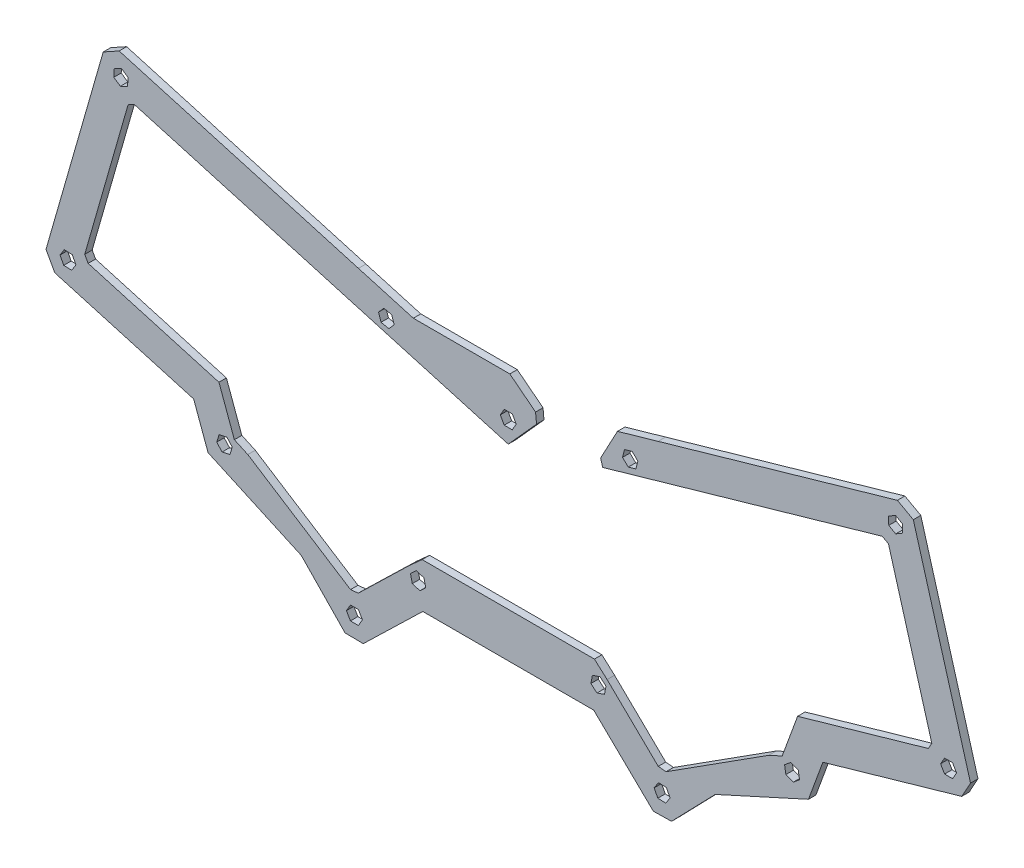
from build123d import *

# Parameters (mm, degrees)
BOSS_EXTRU_1_DEPTH = 3


with BuildPart() as part:
    # Esquisse1 → Boss.-Extru.1 (new body)
    with BuildSketch(Plane.XY):
        Polygon((-207.540430482, -98.290842938), (-228.119574859, -118.248029963), (-231.240854108, -118.563827288), (-272.565847516, -92.169507978), (-277.959789872, -89.716454796), (-284.165989399, -72.783703169), (-336.775785376, -57.698086926), (-338.147034057, -55.224288823), (-320.713145188, 5.574907028), (-318.239316427, 6.946262636), (-167.795259872, -36.183821192), (-156.425730461, -23.544541546), (-156.815310501, -19.508703235), (-167.175777529, -11.401531345), (-205.982988252, -11.401531345), (-221.327812729, -7.001473731), (-228.053301524, -5.072970852), (-324.305573392, 22.521130566), (-330.707501003, 18.97225141), (-353.72243999, -61.290379239), (-350.173829458, -67.692242105), (-294.328030452, -83.705767284), (-288.532091821, -99.519179156), (-251.042661762, -116.568594893), (-233.45174982, -134.735979634), (-226.135810249, -134.851076098), (-202.175390102, -111.650948678), (-133.415129641, -111.650948678), (-109.454709494, -134.851076098), (-102.138769923, -134.735979634), (-84.547857981, -116.568594893), (-47.058427922, -99.519179156), (-41.262489291, -83.705767284), (14.583309715, -67.692242105), (18.131920247, -61.290379239), (-4.88301874, 18.97225141), (-11.284946351, 22.521130566), (-107.537218219, -5.072970852), (-114.262707014, -7.001473731), (-123.876268292, -9.758118068), (-130.649820486, -22.415487094), (-129.8232917, -25.297935522), (-127.904950096, -24.747859919), (-17.351203316, 6.946262636), (-14.877374555, 5.574907028), (2.556514314, -55.224288823), (1.185265633, -57.698086926), (-51.424530344, -72.783703169), (-57.630729871, -89.716454796), (-63.024672228, -92.169507978), (-104.349665635, -118.563827288), (-107.470944884, -118.248029963), (-128.050089261, -98.290842938), (-133.151477342, -93.715936913), (-202.439042401, -93.715936913), align=None)
        Polygon((-214.696831686, -14.527657653), (-217.840116073, -13.876277124), (-219.975870353, -16.272750989), (-218.968340246, -19.320605385), (-215.825055858, -19.971985915), (-213.689301579, -17.575512049), align=None, mode=Mode.SUBTRACT)
        Polygon((-166.175746894, -24.833958909), (-169.385770719, -24.817214521), (-171.005283697, -27.588804506), (-169.414772849, -30.37713888), (-166.204749024, -30.393883267), (-164.585236046, -27.622293282), align=None, mode=Mode.SUBTRACT)
        Polygon((-115.672169645, -16.039488624), (-117.981174931, -13.809459943), (-121.066939064, -14.694102838), (-121.84369791, -17.808774414), (-119.534692623, -20.038803095), (-116.448928491, -19.154160201), align=None, mode=Mode.SUBTRACT)
        Polygon((-9.240055353, 15.320178943), (-12.039253575, 16.891491339), (-14.799649138, 15.252970767), (-14.76084648, 12.043137798), (-11.961648258, 10.471825402), (-9.201252694, 12.110345974), align=None, mode=Mode.SUBTRACT)
        Polygon((12.502351781, -60.574933915), (10.897318032, -57.794933915), (7.687250536, -57.794933915), (6.082216787, -60.574933915), (7.687250536, -63.354933915), (10.897318032, -63.354933915), align=None, mode=Mode.SUBTRACT)
        Polygon((-50.649763202, -94.526851626), (-51.178552765, -91.36063702), (-54.18496983, -90.235474912), (-56.662597331, -92.27652741), (-56.133807767, -95.442742016), (-53.127390703, -96.567904124), align=None, mode=Mode.SUBTRACT)
        Polygon((-104.440215275, -129.559925429), (-102.716844109, -126.851692582), (-104.200556971, -124.005092948), (-107.407640999, -123.866726161), (-109.131012166, -126.574959009), (-107.647299303, -129.421558643), align=None, mode=Mode.SUBTRACT)
        Polygon((-132.134816884, -105.032961295), (-129.102521286, -103.979530359), (-128.498671438, -100.826769871), (-130.927117189, -98.727440319), (-133.959412787, -99.780871255), (-134.563262635, -102.933631743), align=None, mode=Mode.SUBTRACT)
        Polygon((-200.986265397, -102.807259839), (-201.720052379, -99.68218544), (-204.793339689, -98.755126408), (-207.132840016, -100.953141775), (-206.399053033, -104.078216174), (-203.325765724, -105.005275206), align=None, mode=Mode.SUBTRACT)
        Polygon((-228.072581173, -129.499661036), (-226.456549288, -126.726039887), (-228.050559721, -123.939704646), (-231.260602039, -123.926990555), (-232.876633924, -126.700611704), (-231.282623491, -129.486946945), align=None, mode=Mode.SUBTRACT)
        Polygon((-279.761510176, -95.764600045), (-278.801584282, -92.701419409), (-280.974413583, -90.338508881), (-284.107168778, -91.03877899), (-285.067094671, -94.101959627), (-282.89426537, -96.464870154), align=None, mode=Mode.SUBTRACT)
        Polygon((-343.381773974, -63.412440235), (-341.674936445, -60.693756917), (-343.175966498, -57.856250598), (-346.38383408, -57.737427596), (-348.09067161, -60.456110913), (-346.589641557, -63.293617233), align=None, mode=Mode.SUBTRACT)
        Polygon((-323.377643582, 16.884689567), (-326.25776259, 15.467139628), (-326.470187835, 12.264108431), (-323.802494072, 10.478627174), (-320.922375064, 11.896177113), (-320.709949819, 15.09920831), align=None, mode=Mode.SUBTRACT)
    extrude(amount=BOSS_EXTRU_1_DEPTH)


solid = part.part
